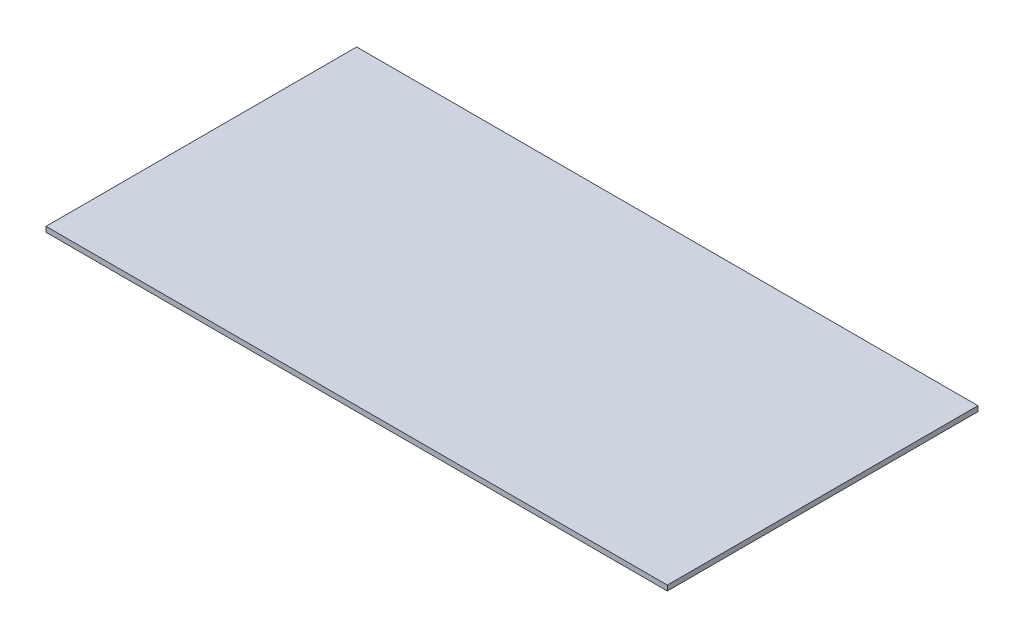
from build123d import *

# Parameters (mm, degrees)
SKETCH1_W           = 304.8
SKETCH1_H           = 152.4
BOSS_EXTRUDE1_DEPTH = 2.54


with BuildPart() as part:
    # Sketch1 → Boss-Extrude1 (new body)
    with BuildSketch(Plane(origin=(0, 0, 0), x_dir=(1, 0, 0), z_dir=(0, 1, 0))):
        Rectangle(SKETCH1_W, SKETCH1_H)
    extrude(amount=BOSS_EXTRUDE1_DEPTH)


solid = part.part
